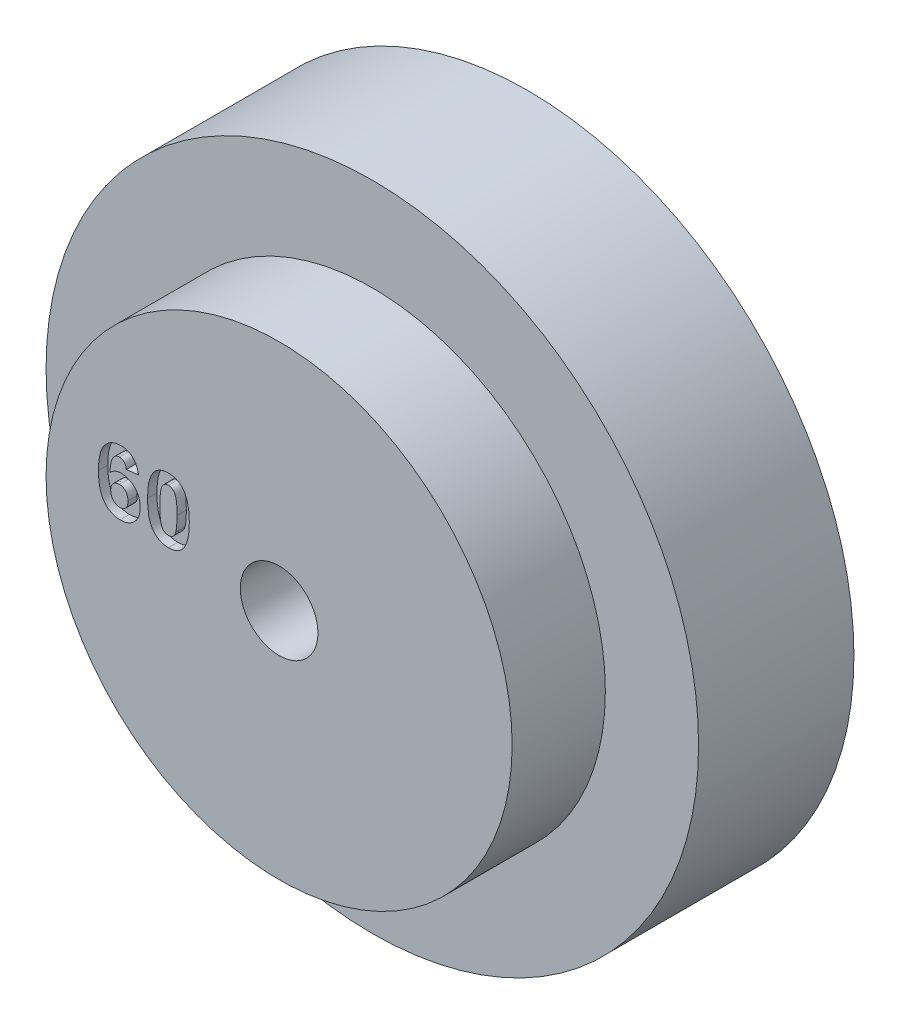
from build123d import *

# Parameters (mm, degrees)
SKETCH1_R           = 21
SKETCH1_R_2         = 2.5
BOSS_EXTRUDE1_DEPTH = 10
SKETCH2_R           = 15
SKETCH2_R_2         = 2.5
BOSS_EXTRUDE2_DEPTH = 6
CUT_EXTRUDE1_DEPTH  = 0.6


with BuildPart() as part:
    # Sketch1 → Boss-Extrude1 (new body)
    with BuildSketch(Plane.XY):
        Circle(SKETCH1_R)
        Circle(SKETCH1_R_2, mode=Mode.SUBTRACT)
    extrude(amount=BOSS_EXTRUDE1_DEPTH)

    # Sketch2 → Boss-Extrude2 (add)
    with BuildSketch(Plane.XY.offset(10)):
        Circle(SKETCH2_R)
        Circle(SKETCH2_R_2, mode=Mode.SUBTRACT)
    extrude(amount=BOSS_EXTRUDE2_DEPTH)

    # Sketch3 → Cut-Extrude1 (cut)
    # profile 1 of 2: a face of its own
    with BuildSketch(Plane.XY.offset(16)):
        with BuildLine():
            Line((-9.046768997, 3.036707573), (-9.8370209, 2.950273771))
            add(Edge.make_bspline(
                [(-9.8370209, 2.950273771), (-9.84231533, 2.9883358), (-9.852278481, 3.059961584), (-9.881788823, 3.158805117), (-9.922870555, 3.241957757), (-9.975602942, 3.309535766), (-10.03841277, 3.361546608), (-10.109981179, 3.398503484), (-10.19026268, 3.420441986), (-10.246548779, 3.423063626), (-10.275775342, 3.424424913)],
                knots=[0, 0, 0, 0, 1.280716388, 2.410074291, 3.425374506, 4.35753932, 5.248331359, 6.12451615, 7.026154803, 8, 8, 8, 8], degree=3))
            add(Edge.make_bspline(
                [(-10.275775342, 3.424424913), (-10.295594685, 3.423940287), (-10.335034176, 3.422975906), (-10.392482586, 3.410732101), (-10.447869763, 3.392562213), (-10.500743671, 3.366828399), (-10.551368121, 3.333623683), (-10.598973501, 3.292551176), (-10.645748427, 3.245775905), (-10.688939767, 3.189292572), (-10.730376833, 3.122412343), (-10.766055821, 3.040538328), (-10.797856528, 2.943746592), (-10.825084738, 2.831563076), (-10.84979406, 2.704699848), (-10.870048688, 2.562643353), (-10.886256322, 2.405265957), (-10.894031755, 2.295049633), (-10.898098716, 2.2374007)],
                knots=[0, 0, 0, 0, 0.642458078, 1.278459126, 1.898279436, 2.531842133, 3.181731979, 3.858193002, 4.57010051, 5.325711302, 6.161524323, 7.118599443, 8.217371811, 9.466325973, 10.864147948, 12.412648259, 14.123626419, 16, 16, 16, 16], degree=3))
            add(Edge.make_bspline(
                [(-10.898098716, 2.2374007), (-10.872842157, 2.264832651), (-10.823316702, 2.318623821), (-10.741138342, 2.388755147), (-10.655044282, 2.448712746), (-10.564097696, 2.497902645), (-10.467802166, 2.534508344), (-10.367902009, 2.562302348), (-10.263089525, 2.577871184), (-10.191859404, 2.580268771), (-10.155591199, 2.58148955)],
                knots=[0, 0, 0, 0, 1.057745406, 2.074127497, 3.059409796, 4.031705469, 5.000875988, 5.977809597, 6.970362319, 8, 8, 8, 8], degree=3))
            add(Edge.make_bspline(
                [(-10.155591199, 2.58148955), (-10.114659506, 2.580310719), (-10.033833951, 2.577982948), (-9.914759145, 2.561656434), (-9.800499048, 2.532298428), (-9.690536768, 2.492584451), (-9.584328824, 2.442574653), (-9.483906862, 2.379269714), (-9.38769452, 2.305458999), (-9.297015003, 2.221131154), (-9.213702333, 2.128293279), (-9.140145486, 2.02802103), (-9.079610617, 1.920008196), (-9.027860556, 1.806673024), (-8.989356535, 1.685778152), (-8.961406686, 1.559063256), (-8.944722594, 1.425365197), (-8.942526331, 1.334146398), (-8.941402077, 1.287452059)],
                knots=[0, 0, 0, 0, 0.99135015, 1.957564468, 2.903754199, 3.843479786, 4.78583385, 5.741106244, 6.712813504, 7.719198368, 8.735844933, 9.730198001, 10.724351158, 11.729813921, 12.742848014, 13.790983496, 14.86921809, 16, 16, 16, 16], degree=3))
            add(Edge.make_bspline(
                [(-8.941402077, 1.287452059), (-8.94254274, 1.238019701), (-8.944767306, 1.141614756), (-8.961141672, 1.000427433), (-8.99006576, 0.867162497), (-9.029582308, 0.740750755), (-9.080695813, 0.622193885), (-9.142615678, 0.510514852), (-9.217437319, 0.407622161), (-9.301765158, 0.312131758), (-9.39577401, 0.226918935), (-9.49596075, 0.151461977), (-9.603436595, 0.088736811), (-9.716612917, 0.035942843), (-9.837433602, -0.002801001), (-9.963768604, -0.031856936), (-10.096645187, -0.049578459), (-10.187366051, -0.05163236), (-10.23379321, -0.05268346)],
                knots=[0, 0, 0, 0, 1.13287417, 2.209376133, 3.25169942, 4.254157582, 5.240146322, 6.205890558, 7.174579019, 8.150183866, 9.1206468, 10.07783463, 11.019441811, 11.967766696, 12.934309213, 13.921380422, 14.936249089, 16, 16, 16, 16], degree=3))
            add(Edge.make_bspline(
                [(-10.23379321, -0.05268346), (-10.283539011, -0.051291711), (-10.381348107, -0.048555283), (-10.524529758, -0.026035875), (-10.66065468, 0.012063403), (-10.789705962, 0.065270669), (-10.912756237, 0.132197171), (-11.028662894, 0.215332088), (-11.137118785, 0.313882628), (-11.23955841, 0.426514188), (-11.332775724, 0.55661254), (-11.412160384, 0.706978874), (-11.479486529, 0.87596638), (-11.534299876, 1.064008445), (-11.576611822, 1.271090155), (-11.606136139, 1.497228875), (-11.625746455, 1.742050624), (-11.627401377, 1.911655028), (-11.628258547, 1.999501951)],
                knots=[0, 0, 0, 0, 0.852151446, 1.675481364, 2.476404467, 3.269281233, 4.062617998, 4.871616733, 5.707301388, 6.56955125, 7.476395267, 8.442009786, 9.475854496, 10.58877921, 11.794095973, 13.094195288, 14.494932947, 16, 16, 16, 16], degree=3))
            add(Edge.make_bspline(
                [(-11.628258547, 1.999501951), (-11.627029914, 2.089539508), (-11.6246559, 2.263513769), (-11.605552432, 2.514708779), (-11.575208257, 2.746676694), (-11.531004363, 2.958894414), (-11.474464167, 3.151802274), (-11.405918314, 3.325787946), (-11.323644717, 3.480221557), (-11.227988786, 3.614600871), (-11.122739696, 3.731411865), (-11.009649086, 3.832239585), (-10.889148697, 3.918059001), (-10.761241421, 3.988653406), (-10.624877244, 4.042170629), (-10.481349622, 4.080816755), (-10.33041748, 4.105654008), (-10.227031349, 4.108078541), (-10.174524317, 4.109309896)],
                knots=[0, 0, 0, 0, 1.491699013, 2.882321987, 4.171520357, 5.365488089, 6.470299549, 7.49861535, 8.458736801, 9.361983288, 10.224742848, 11.058789056, 11.867429157, 12.671146298, 13.473202851, 14.288259215, 15.130652936, 16, 16, 16, 16], degree=3))
            add(Edge.make_bspline(
                [(-10.174524317, 4.109309896), (-10.137436699, 4.10864267), (-10.064935148, 4.107338328), (-9.95867369, 4.09348731), (-9.857301247, 4.072306859), (-9.760552128, 4.042988198), (-9.669107513, 4.003724839), (-9.582604277, 3.955892977), (-9.500751612, 3.899622155), (-9.423975403, 3.835274662), (-9.352893571, 3.762655754), (-9.288708322, 3.681601128), (-9.230994589, 3.593089012), (-9.179499788, 3.497192863), (-9.136306797, 3.392994237), (-9.099175294, 3.281312526), (-9.068637215, 3.161907795), (-9.054169548, 3.079077309), (-9.046768997, 3.036707573)],
                knots=[0, 0, 0, 0, 1.036027791, 2.025301876, 2.989435482, 3.928225244, 4.845595412, 5.765526461, 6.686607585, 7.61747015, 8.561102691, 9.521661062, 10.50224679, 11.510949117, 12.559251378, 13.650572309, 14.798212656, 16, 16, 16, 16], degree=3))
        make_face()
        with BuildLine():
            add(Edge.make_bspline(
                [(-10.838006644, 1.305561998), (-10.837706601, 1.279462984), (-10.837120335, 1.228467008), (-10.827506636, 1.154468129), (-10.813687771, 1.085095507), (-10.795074525, 1.019963906), (-10.769275306, 0.960059063), (-10.7386668, 0.904179433), (-10.702461175, 0.85283135), (-10.646908025, 0.792585056), (-10.570144169, 0.729308195), (-10.469402875, 0.672960371), (-10.361461292, 0.637933781), (-10.287006774, 0.634124075), (-10.249433612, 0.632201522)],
                knots=[0, 0, 0, 0, 0.93816693, 1.833124408, 2.679057427, 3.481731691, 4.264557977, 5.020023694, 5.770442996, 6.518065735, 7.962605608, 9.32780964, 10.651490302, 12, 12, 12, 12], degree=3))
            add(Edge.make_bspline(
                [(-10.249433612, 0.632201522), (-10.213840299, 0.633799005), (-10.144561776, 0.636908331), (-10.04563042, 0.665325274), (-9.955766229, 0.710141736), (-9.889888808, 0.762756708), (-9.84395391, 0.81393122), (-9.813086708, 0.858809818), (-9.787960775, 0.910005126), (-9.76741904, 0.966673973), (-9.750872826, 1.028597163), (-9.73957595, 1.09639688), (-9.733168214, 1.169887444), (-9.732170718, 1.220761619), (-9.73165398, 1.247116284)],
                knots=[0, 0, 0, 0, 1.399678333, 2.724321989, 4.020062797, 5.33532049, 6.016755754, 6.724441967, 7.473839083, 8.257094862, 9.096253071, 9.995581596, 10.961638663, 12, 12, 12, 12], degree=3))
            add(Edge.make_bspline(
                [(-9.73165398, 1.247116284), (-9.732094753, 1.274298723), (-9.732946902, 1.326850546), (-9.740403862, 1.402805419), (-9.75260319, 1.473022636), (-9.769658801, 1.537998355), (-9.792745396, 1.59686346), (-9.819981881, 1.650805258), (-9.853049374, 1.698361007), (-9.902193137, 1.75429269), (-9.973650068, 1.810651444), (-10.069129997, 1.861985318), (-10.176152863, 1.891086828), (-10.250636097, 1.894730474), (-10.288946207, 1.896604567)],
                knots=[0, 0, 0, 0, 1.008384627, 1.949510571, 2.828269698, 3.650667555, 4.437180943, 5.170285793, 5.887596972, 6.580056709, 7.926803404, 9.238379296, 10.579573008, 12, 12, 12, 12], degree=3))
            add(Edge.make_bspline(
                [(-10.288946207, 1.896604567), (-10.326193358, 1.895087351), (-10.398533165, 1.892140678), (-10.502494025, 1.862549783), (-10.597619287, 1.815465561), (-10.667684784, 1.760151062), (-10.71706823, 1.708018911), (-10.749412241, 1.663632031), (-10.777566117, 1.615306073), (-10.799799907, 1.56179146), (-10.816941817, 1.504092434), (-10.829236607, 1.441814715), (-10.836676606, 1.37516483), (-10.837555337, 1.329179552), (-10.838006644, 1.305561998)],
                knots=[0, 0, 0, 0, 1.469034193, 2.853094746, 4.235454457, 5.641396914, 6.354997179, 7.06867986, 7.807229614, 8.560602297, 9.353235934, 10.182779392, 11.06669468, 12, 12, 12, 12], degree=3))
        make_face(mode=Mode.SUBTRACT)
    # profile 2 of 2: a face of its own
    with BuildSketch(Plane.XY.offset(16)):
        with BuildLine():
            add(Edge.make_bspline(
                [(-7.1238227, 4.109309896), (-7.074908221, 4.10813011), (-6.979677337, 4.105833203), (-6.840915454, 4.085486764), (-6.710264235, 4.052862383), (-6.587733268, 4.006745509), (-6.473437344, 3.946860082), (-6.368137789, 3.872950188), (-6.269533666, 3.787231353), (-6.212593388, 3.720712116), (-6.183752207, 3.687019035)],
                knots=[0, 0, 0, 0, 1.098584764, 2.138818609, 3.143716932, 4.11936356, 5.073598562, 6.034819447, 7.004603936, 8, 8, 8, 8], degree=3))
            add(Edge.make_bspline(
                [(-6.183752207, 3.687019035), (-6.16725459, 3.665560994), (-6.133585846, 3.621768892), (-6.088241616, 3.551005692), (-6.044649308, 3.475941546), (-6.006597479, 3.394769632), (-5.970161202, 3.308898552), (-5.936395134, 3.218132645), (-5.90707711, 3.121721971), (-5.879490564, 3.020899306), (-5.857010059, 2.914090045), (-5.836235993, 2.802447259), (-5.819013358, 2.685464819), (-5.805432294, 2.563517004), (-5.793303058, 2.436789353), (-5.786656825, 2.304677134), (-5.781214976, 2.167475342), (-5.780671115, 2.074143043), (-5.780394464, 2.02666686)],
                knots=[0, 0, 0, 0, 0.746761706, 1.524009783, 2.317797294, 3.140957436, 3.996208027, 4.892396322, 5.812273159, 6.776774596, 7.776522781, 8.823794876, 9.910947555, 11.039215469, 12.21036455, 13.424061321, 14.689674014, 16, 16, 16, 16], degree=3))
            add(Edge.make_bspline(
                [(-5.780394464, 2.02666686), (-5.780666948, 1.979190567), (-5.781201042, 1.886132286), (-5.786677112, 1.749205748), (-5.793308983, 1.617368978), (-5.805403998, 1.490634558), (-5.819115094, 1.368710985), (-5.835845325, 1.251859679), (-5.858182669, 1.140729894), (-5.880309528, 1.034090987), (-5.907734345, 0.932839048), (-5.938369868, 0.836601268), (-5.970778789, 0.744703877), (-6.008062213, 0.658722253), (-6.047479353, 0.577449891), (-6.090422927, 0.501619555), (-6.136273463, 0.430417806), (-6.170267932, 0.386394675), (-6.187044923, 0.364668326)],
                knots=[0, 0, 0, 0, 1.308387162, 2.564569672, 3.776470597, 4.945886788, 6.07248526, 7.158029334, 8.197718558, 9.195987466, 10.159061779, 11.087054987, 11.979325145, 12.84323098, 13.668471539, 14.467659354, 15.243757377, 16, 16, 16, 16], degree=3))
            add(Edge.make_bspline(
                [(-6.187044923, 0.364668326), (-6.215622226, 0.331264043), (-6.272035201, 0.265322377), (-6.369548008, 0.180314418), (-6.474672999, 0.107933078), (-6.588767609, 0.049237729), (-6.710699847, 0.002802643), (-6.841564874, -0.028780693), (-6.979947674, -0.049168553), (-7.0751803, -0.051495113), (-7.1238227, -0.05268346)],
                knots=[0, 0, 0, 0, 0.991631672, 1.957528776, 2.911425699, 3.867574088, 4.848108326, 5.850523106, 6.902101959, 8, 8, 8, 8], degree=3))
            add(Edge.make_bspline(
                [(-7.1238227, -0.05268346), (-7.173021065, -0.051267794), (-7.269427811, -0.048493724), (-7.410185839, -0.026502877), (-7.543982805, 0.008726323), (-7.670338381, 0.059024228), (-7.789071774, 0.124206623), (-7.901110576, 0.202342339), (-8.004017278, 0.296969382), (-8.084581996, 0.38506194), (-8.143523387, 0.464660043), (-8.185094382, 0.530665638), (-8.225268318, 0.60129426), (-8.259943254, 0.678754113), (-8.29415316, 0.760754167), (-8.324452385, 0.849061637), (-8.351184152, 0.942917163), (-8.376283579, 1.041892173), (-8.397212804, 1.146668415), (-8.416464619, 1.256936687), (-8.431636087, 1.373165933), (-8.445087157, 1.494708772), (-8.45455748, 1.621852118), (-8.46224859, 1.754387908), (-8.466105152, 1.892740385), (-8.466863894, 1.986878088), (-8.467250935, 2.03489865)],
                knots=[0, 0, 0, 0, 1.257818097, 2.464759732, 3.634271214, 4.790227596, 5.933394726, 7.09190477, 8.274482889, 9.50191983, 10.139172818, 10.805000628, 11.49619854, 12.215266328, 12.973768034, 13.768328009, 14.601232062, 15.469317089, 16.379095881, 17.333267023, 18.331755967, 19.376479622, 20.460535752, 21.592206075, 22.771760786, 24, 24, 24, 24], degree=3))
            add(Edge.make_bspline(
                [(-8.467250935, 2.03489865), (-8.466980627, 2.082100736), (-8.466450859, 2.174610759), (-8.460934856, 2.310985862), (-8.454390626, 2.442281278), (-8.442163965, 2.568726811), (-8.428645176, 2.690129758), (-8.41160496, 2.806650177), (-8.389822991, 2.917685215), (-8.366107141, 3.02367803), (-8.340092476, 3.125003995), (-8.309172157, 3.220816136), (-8.277087158, 3.312563563), (-8.239367969, 3.398086561), (-8.200192826, 3.479187869), (-8.157215649, 3.555003995), (-8.111373571, 3.626209321), (-8.077378008, 3.670231989), (-8.060600476, 3.69195811)],
                knots=[0, 0, 0, 0, 1.304469132, 2.556591843, 3.77188756, 4.93702727, 6.066781583, 7.147865049, 8.190466662, 9.19316792, 10.149665317, 11.080258032, 11.975027628, 12.834388201, 13.661940433, 14.463366943, 15.241638981, 16, 16, 16, 16], degree=3))
            add(Edge.make_bspline(
                [(-8.060600476, 3.69195811), (-8.032024745, 3.725365606), (-7.975614873, 3.791313615), (-7.878079353, 3.876275136), (-7.772838137, 3.948968905), (-7.658409621, 4.006961698), (-7.536756903, 4.054033388), (-7.406063138, 4.085364694), (-7.267702386, 4.105806365), (-7.172466675, 4.108125395), (-7.1238227, 4.109309896)],
                knots=[0, 0, 0, 0, 0.991667276, 1.957599061, 2.911530233, 3.873218945, 4.847995157, 5.850445929, 6.902062539, 8, 8, 8, 8], degree=3))
        make_face()
        with BuildLine():
            add(Edge.make_bspline(
                [(-7.1238227, 3.424424913), (-7.148880606, 3.423276662), (-7.198447435, 3.421005316), (-7.270491717, 3.404172435), (-7.3385316, 3.376394513), (-7.402895079, 3.337616893), (-7.462159885, 3.283671889), (-7.512362486, 3.211343219), (-7.555718515, 3.122583945), (-7.577415827, 3.056240048), (-7.588918872, 3.021067171)],
                knots=[0, 0, 0, 0, 0.899391665, 1.779078861, 2.640979247, 3.529945348, 4.464599804, 5.495588918, 6.672261578, 8, 8, 8, 8], degree=3))
            add(Edge.make_bspline(
                [(-7.588918872, 3.021067171), (-7.596102722, 2.994528263), (-7.611542717, 2.937489125), (-7.629066469, 2.844491625), (-7.643517947, 2.738949308), (-7.65572076, 2.620886701), (-7.665651278, 2.490241328), (-7.671766832, 2.346930061), (-7.675993793, 2.191053318), (-7.676655035, 2.082920633), (-7.676999032, 2.02666686)],
                knots=[0, 0, 0, 0, 0.658986521, 1.416336438, 2.266694271, 3.212608458, 4.261595115, 5.407496572, 6.651304179, 8, 8, 8, 8], degree=3))
            add(Edge.make_bspline(
                [(-7.676999032, 2.02666686), (-7.676530053, 1.970691374), (-7.6756311, 1.863395754), (-7.673078371, 1.709393598), (-7.665832407, 1.569208237), (-7.658579896, 1.442281015), (-7.64650052, 1.329011867), (-7.63435118, 1.229094931), (-7.617605312, 1.143212597), (-7.594756544, 1.049800121), (-7.560200711, 0.952029146), (-7.512791141, 0.853392579), (-7.461951865, 0.774192035), (-7.402072313, 0.717484975), (-7.337265093, 0.679444488), (-7.270047014, 0.651494143), (-7.198068337, 0.635810201), (-7.148863441, 0.633418617), (-7.1238227, 0.632201522)],
                knots=[0, 0, 0, 0, 1.613353868, 3.092528792, 4.438413522, 5.658843895, 6.755779493, 7.721003256, 8.558527904, 9.275869043, 10.491421475, 11.538327284, 12.426656321, 13.187490948, 13.890032692, 14.581719216, 15.278226227, 16, 16, 16, 16], degree=3))
            add(Edge.make_bspline(
                [(-7.1238227, 0.632201522), (-7.098476615, 0.633291536), (-7.048875296, 0.635424651), (-6.976736623, 0.652818777), (-6.908599864, 0.679761442), (-6.844667056, 0.719329691), (-6.785457758, 0.772905321), (-6.735291806, 0.845298988), (-6.691924188, 0.934037708), (-6.670228639, 1.000384731), (-6.658726528, 1.035559265)],
                knots=[0, 0, 0, 0, 0.909107913, 1.77908945, 2.650019014, 3.530482969, 4.465025013, 5.495890128, 6.672421267, 8, 8, 8, 8], degree=3))
            add(Edge.make_bspline(
                [(-6.658726528, 1.035559265), (-6.65155307, 1.062100279), (-6.636205692, 1.118883908), (-6.618557068, 1.211302473), (-6.604066466, 1.316297875), (-6.591979677, 1.433823415), (-6.58195148, 1.564186582), (-6.575887839, 1.707227559), (-6.571656902, 1.862829081), (-6.570991643, 1.97068744), (-6.570646368, 2.02666686)],
                knots=[0, 0, 0, 0, 0.66114423, 1.414496391, 2.261103113, 3.210114492, 4.255954433, 5.405607896, 6.653488082, 8, 8, 8, 8], degree=3))
            add(Edge.make_bspline(
                [(-6.570646368, 2.02666686), (-6.570608191, 2.082648207), (-6.570535006, 2.189963512), (-6.575383746, 2.344161144), (-6.58014236, 2.484759441), (-6.589845986, 2.611482981), (-6.599565022, 2.72475974), (-6.614043973, 2.824022582), (-6.628630376, 2.910365564), (-6.653558574, 3.003583379), (-6.687436198, 3.101635331), (-6.73371944, 3.201296843), (-6.786037848, 3.279754962), (-6.84548339, 3.337425612), (-6.909971626, 3.376302235), (-6.977354669, 3.404337395), (-7.049210371, 3.420977552), (-7.098768959, 3.423267339), (-7.1238227, 3.424424913)],
                knots=[0, 0, 0, 0, 1.611146624, 3.088541111, 4.440175916, 5.659517762, 6.746360572, 7.711365618, 8.546319149, 9.264661039, 10.486047304, 11.528122518, 12.419721574, 13.184982167, 13.89070983, 14.574167459, 15.279187713, 16, 16, 16, 16], degree=3))
        make_face(mode=Mode.SUBTRACT)
    extrude(amount=-CUT_EXTRUDE1_DEPTH, mode=Mode.SUBTRACT)


solid = part.part
